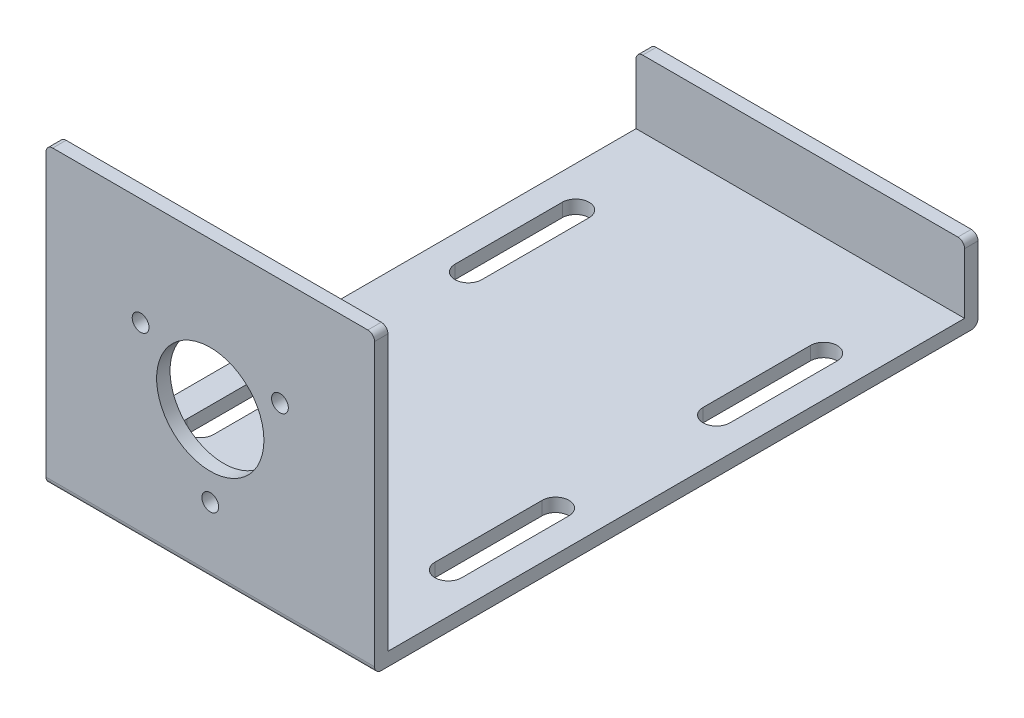
from build123d import *

# Parameters (mm, degrees)
BOSS_EXTRUDE2_DEPTH = 49
CUT_EXTRUDE1_REACH  = 113.521
SKETCH4_R           = 1.25
SKETCH4_R_2         = 8
CUT_EXTRUDE3_REACH  = 113.521
FILLET2_R           = 1


with BuildPart() as part:
    # Sketch3 → Boss-Extrude2 (new body)
    with BuildSketch(Plane(origin=(0, 0, 0), x_dir=(0, 0, -1), z_dir=(1, 0, 0))):
        Polygon((0, 0), (2, 0), (2, -42), (88, -42), (88, -32), (90, -32), (90, -44), (0, -44), align=None)
    extrude(amount=BOSS_EXTRUDE2_DEPTH)

    # Sketch4 → Cut-Extrude1 (cut, up to next)
    with BuildSketch(Plane.XY, mode=Mode.PRIVATE) as cut_extrude1_sk1:
        with Locations((24.5, -34)):
            Circle(SKETCH4_R)
    cut_extrude1_tool1 = extrude(cut_extrude1_sk1.sketch, amount=-CUT_EXTRUDE1_REACH, mode=Mode.PRIVATE) & part.part
    # Sketch4 → Cut-Extrude1 (cut, up to next)
    with BuildSketch(Plane.XY, mode=Mode.PRIVATE) as cut_extrude1_sk2:
        with Locations((14.107695155, -16)):
            Circle(SKETCH4_R)
    cut_extrude1_tool2 = extrude(cut_extrude1_sk2.sketch, amount=-CUT_EXTRUDE1_REACH, mode=Mode.PRIVATE) & part.part
    # Sketch4 → Cut-Extrude1 (cut, up to next)
    with BuildSketch(Plane.XY, mode=Mode.PRIVATE) as cut_extrude1_sk3:
        with Locations((34.892304845, -16)):
            Circle(SKETCH4_R)
    cut_extrude1_tool3 = extrude(cut_extrude1_sk3.sketch, amount=-CUT_EXTRUDE1_REACH, mode=Mode.PRIVATE) & part.part
    # Sketch4 → Cut-Extrude1 (cut, up to next)
    with BuildSketch(Plane.XY, mode=Mode.PRIVATE) as cut_extrude1_sk4:
        with Locations((24.5, -22)):
            Circle(SKETCH4_R_2)
    cut_extrude1_tool4 = extrude(cut_extrude1_sk4.sketch, amount=-CUT_EXTRUDE1_REACH, mode=Mode.PRIVATE) & part.part
    add(cut_extrude1_tool1.solids().sort_by_distance((24.5, -34, 0))[0], mode=Mode.SUBTRACT)
    add(cut_extrude1_tool2.solids().sort_by_distance((14.107695, -16, 0))[0], mode=Mode.SUBTRACT)
    add(cut_extrude1_tool3.solids().sort_by_distance((34.892305, -16, 0))[0], mode=Mode.SUBTRACT)
    add(cut_extrude1_tool4.solids().sort_by_distance((24.5, -22, 0))[0], mode=Mode.SUBTRACT)

    # Sketch5 → Cut-Extrude3 (cut, up to next)
    with BuildSketch(Plane.XZ.offset(44), mode=Mode.PRIVATE) as cut_extrude3_sk1:
        with BuildLine():
            Line((41, -17), (41, -33))
            ThreePointArc((41, -33), (43, -35), (45, -33))
            Line((45, -33), (45, -17))
            ThreePointArc((45, -17), (43, -15), (41, -17))
        make_face()
    cut_extrude3_tool1 = extrude(cut_extrude3_sk1.sketch, amount=-CUT_EXTRUDE3_REACH, mode=Mode.PRIVATE) & part.part
    # Sketch5 → Cut-Extrude3 (cut, up to next)
    with BuildSketch(Plane.XZ.offset(44), mode=Mode.PRIVATE) as cut_extrude3_sk2:
        with BuildLine():
            Line((45, -73), (45, -57))
            ThreePointArc((45, -57), (43, -55), (41, -57))
            Line((41, -57), (41, -73))
            ThreePointArc((41, -73), (43, -75), (45, -73))
        make_face()
    cut_extrude3_tool2 = extrude(cut_extrude3_sk2.sketch, amount=-CUT_EXTRUDE3_REACH, mode=Mode.PRIVATE) & part.part
    # Sketch5 → Cut-Extrude3 (cut, up to next)
    with BuildSketch(Plane.XZ.offset(44), mode=Mode.PRIVATE) as cut_extrude3_sk3:
        with BuildLine():
            Line((8, -73), (8, -57))
            ThreePointArc((8, -57), (6, -55), (4, -57))
            Line((4, -57), (4, -73))
            ThreePointArc((4, -73), (6, -75), (8, -73))
        make_face()
    cut_extrude3_tool3 = extrude(cut_extrude3_sk3.sketch, amount=-CUT_EXTRUDE3_REACH, mode=Mode.PRIVATE) & part.part
    # Sketch5 → Cut-Extrude3 (cut, up to next)
    with BuildSketch(Plane.XZ.offset(44), mode=Mode.PRIVATE) as cut_extrude3_sk4:
        with BuildLine():
            Line((4, -17), (4, -33))
            ThreePointArc((4, -33), (6, -35), (8, -33))
            Line((8, -33), (8, -17))
            ThreePointArc((8, -17), (6, -15), (4, -17))
        make_face()
    cut_extrude3_tool4 = extrude(cut_extrude3_sk4.sketch, amount=-CUT_EXTRUDE3_REACH, mode=Mode.PRIVATE) & part.part
    add(cut_extrude3_tool1.solids().sort_by_distance((43, -44, -25))[0], mode=Mode.SUBTRACT)
    add(cut_extrude3_tool2.solids().sort_by_distance((43, -44, -65))[0], mode=Mode.SUBTRACT)
    add(cut_extrude3_tool3.solids().sort_by_distance((6, -44, -65))[0], mode=Mode.SUBTRACT)
    add(cut_extrude3_tool4.solids().sort_by_distance((6, -44, -25))[0], mode=Mode.SUBTRACT)

    # Fillet2
    fillet2_edges = [part.edges().sort_by_distance(p)[0] for p in [
        (0, 0, -1),
        (24.5, -44, 0),
        (24.5, -44, -90),
        (49, -32, -89),
        (49, 0, -1),
        (0, -32, -89),
    ]]
    fillet(fillet2_edges, radius=FILLET2_R)


solid = part.part
